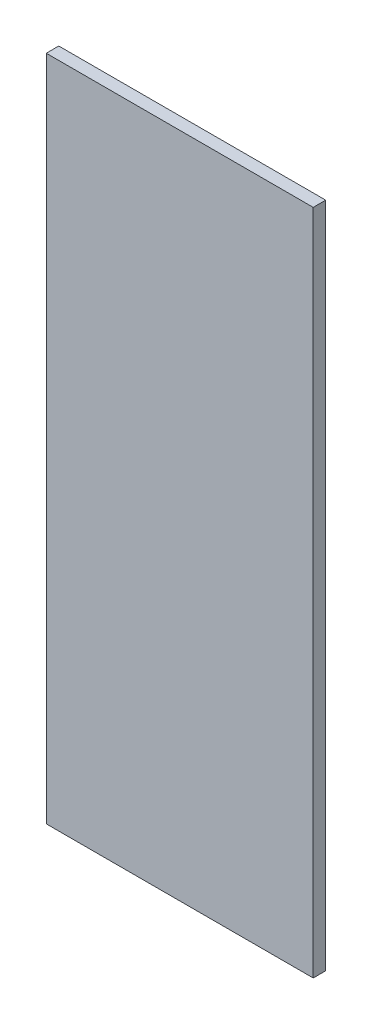
from build123d import *

# Parameters (mm, degrees)
ESBO_O1_W                = 320
ESBO_O1_H                = 800
RESSALTO_EXTRUS_O1_DEPTH = 15


with BuildPart() as part:
    # Esboço1 → Ressalto-extrusão1 (new body)
    with BuildSketch(Plane.XY):
        Rectangle(ESBO_O1_W, ESBO_O1_H)
    extrude(amount=RESSALTO_EXTRUS_O1_DEPTH)


solid = part.part
